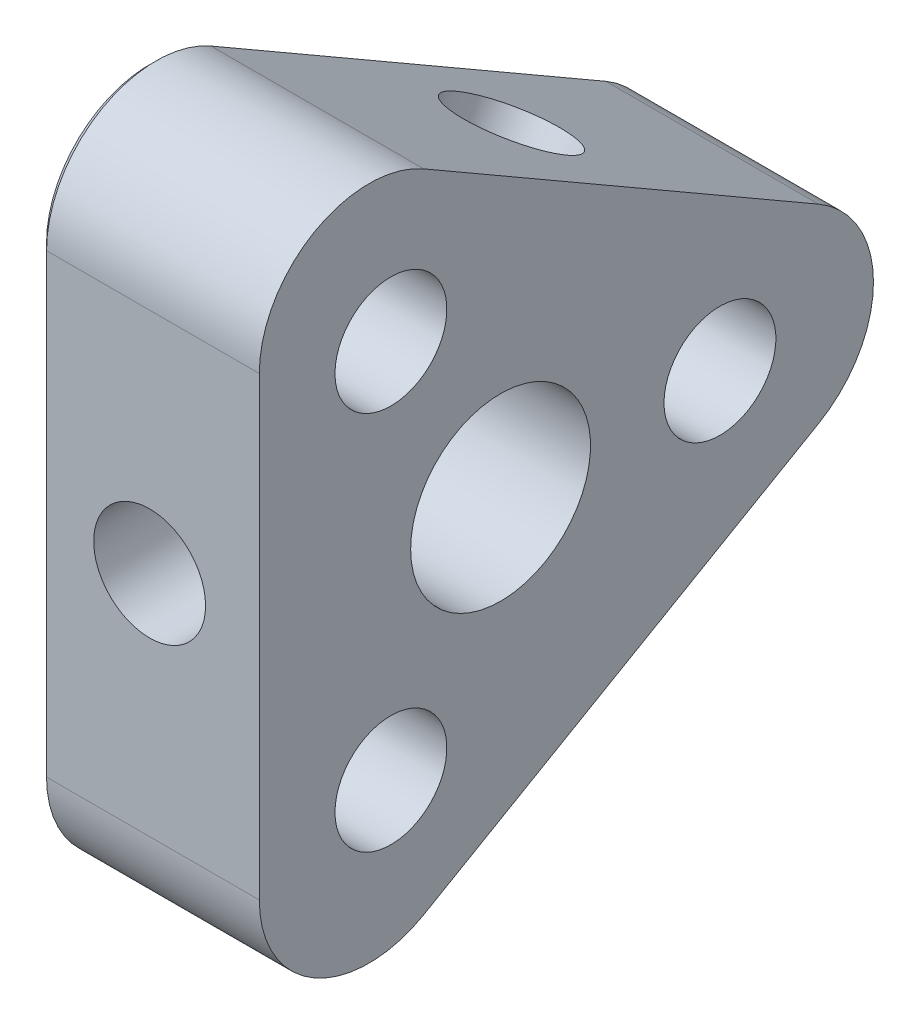
from build123d import *

# Parameters (mm, degrees)
BOSS_EXTRUDE1_DEPTH             = 10
F_5_1_5_1_DIAMETER_HOLE1_D      = 5.1
F_8_2_8_2_DIAMETER_HOLE1_D      = 8.2
F_5_1_5_1_DIAMETER_HOLE2_REACH  = 51.648
F_5_1_5_1_DIAMETER_HOLE2_BORE_R = 2.55
CHAMFER1_SIZE                   = 0.3
SKETCH8_R                       = 2.525
CUT_EXTRUDE1_DEPTH              = 8


with BuildPart() as part:
    # Sketch1 → Boss-Extrude1 (new body)
    with BuildSketch(Plane(origin=(28, 0, 0), x_dir=(0, -1, 0), z_dir=(-1, 0, 0))):
        with BuildLine():
            Line((-14.722431864, 3.5), (-4.330127019, -14.5))
            ThreePointArc((-4.330127019, -14.5), (0, -17), (4.330127019, -14.5))
            Line((4.330127019, -14.5), (14.722431864, 3.5))
            ThreePointArc((14.722431864, 3.5), (14.722431864, 8.5), (10.392304845, 11))
            Line((10.392304845, 11), (-10.392304845, 11))
            ThreePointArc((-10.392304845, 11), (-14.722431864, 8.5), (-14.722431864, 3.5))
        make_face()
    extrude(amount=-BOSS_EXTRUDE1_DEPTH)

    # Ø5.1 (5.1) Diameter Hole1 (through all)
    with Locations(Plane.ZY.offset(-28)):
        with Locations((-10, 0), (5, 8.660254038), (5, -8.660254038)):
            Hole(F_5_1_5_1_DIAMETER_HOLE1_D / 2)

    # Ø8.2 (8.2) Diameter Hole1 (through all)
    with Locations(Plane.ZY.offset(-28)):
        with Locations((0, 0)):
            Hole(F_8_2_8_2_DIAMETER_HOLE1_D / 2)

    # Ø5.1 (5.1) Diameter Hole2 bore → Ø5.1 (5.1) Diameter Hole2 (cut, up to next)
    with BuildSketch(Plane.XY.offset(11), mode=Mode.PRIVATE) as f_5_1_5_1_diameter_hole2_sk1:
        with Locations((33, 0)):
            Circle(F_5_1_5_1_DIAMETER_HOLE2_BORE_R)
    f_5_1_5_1_diameter_hole2_tool1 = extrude(f_5_1_5_1_diameter_hole2_sk1.sketch, amount=-F_5_1_5_1_DIAMETER_HOLE2_REACH, mode=Mode.PRIVATE) & part.part
    add(f_5_1_5_1_diameter_hole2_tool1.solids().sort_by_distance((33, 0, 11))[0], mode=Mode.SUBTRACT)

    # Chamfer1
    chamfer1_edges = [part.edges().sort_by_distance(p)[0] for p in [
        (28, -8.660254038, 7.55),
        (28, 8.660254038, 7.55),
        (28, 0, -7.45),
        (28, 0, 4.1),
        (28, 0, 11),
        (28, -14.722431864, 8.5),
        (28, -9.526279442, -5.5),
        (28, 0, -17),
        (28, 9.526279442, -5.5),
        (28, 14.722431864, 8.5),
    ]]
    chamfer(chamfer1_edges, length=CHAMFER1_SIZE)

    # Sketch8 → Cut-Extrude1 (cut)
    with BuildSketch(Plane(origin=(0, 9.526279442, -5.5), x_dir=(1, 0, 0), z_dir=(0, 0.8660254037844384, -0.5000000000000006))):
        with Locations(Location((33, -0.002304845, 0), (0, 0, 270))):
            Circle(SKETCH8_R)
    extrude(amount=-CUT_EXTRUDE1_DEPTH, mode=Mode.SUBTRACT)


solid = part.part
